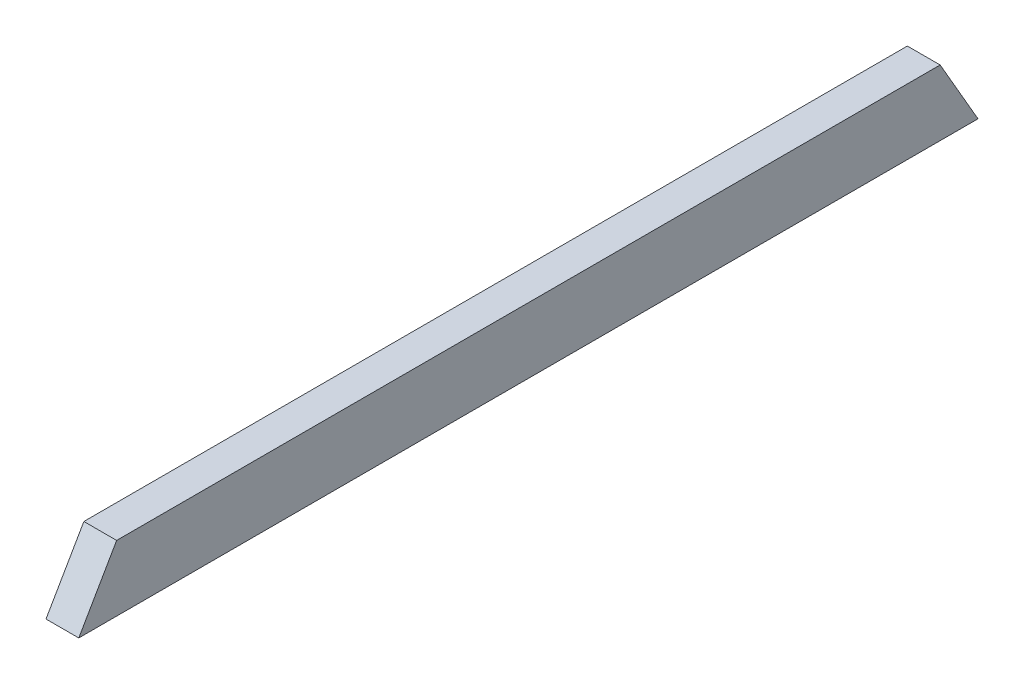
from build123d import *

# Parameters (mm, degrees)
SKETCH1_W           = 44.45
SKETCH1_H           = 88.9
BOSS_EXTRUDE1_DEPTH = 1219.2
CUT_EXTRUDE2_DEPTH  = 88.9


with BuildPart() as part:
    # Sketch1 → Boss-Extrude1 (new body)
    with BuildSketch(Plane.XY):
        with Locations((-22.225, 44.45)):
            Rectangle(SKETCH1_W, SKETCH1_H)
    extrude(amount=BOSS_EXTRUDE1_DEPTH)

    # Sketch3 → Cut-Extrude2 (cut)
    with BuildSketch(Plane(origin=(0, 0, 0), x_dir=(0, 0, -1), z_dir=(1, 0, 0))):
        Polygon((-1219.2, 0), (-1167.873561069, 88.9), (-1219.2, 88.9), align=None)
        Polygon((-51.326438931, 88.9), (0, 88.9), (0, 0), align=None)
    extrude(amount=-CUT_EXTRUDE2_DEPTH, mode=Mode.SUBTRACT)


solid = part.part
